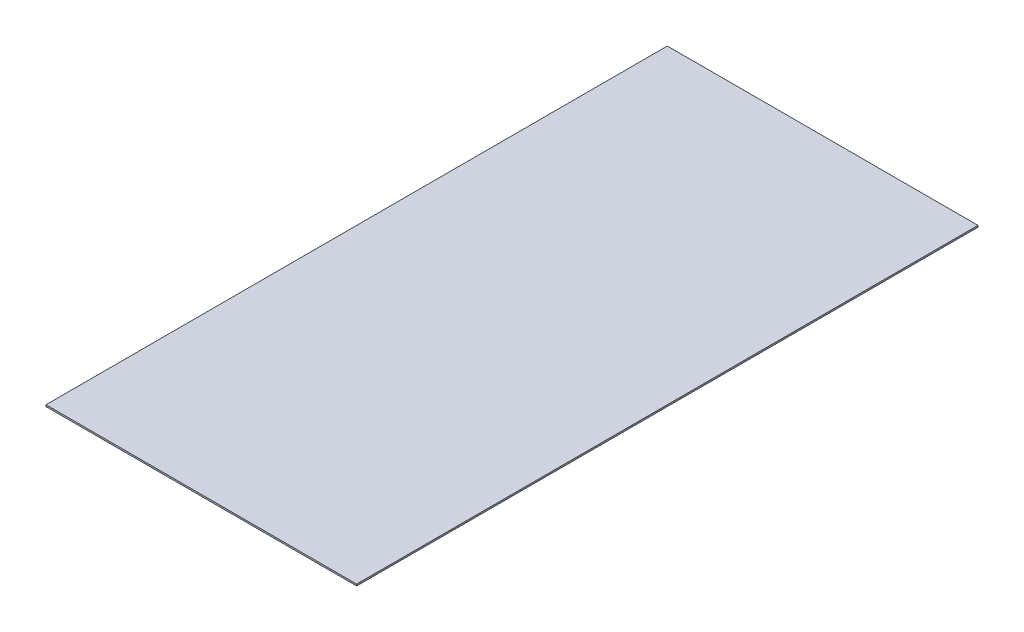
from build123d import *

# Parameters (mm, degrees)
CROQUIS1_W              = 1219.2
CROQUIS1_H              = 2438.4
SALIENTE_EXTRUIR1_DEPTH = 6.4


with BuildPart() as part:
    # Croquis1 → Saliente-Extruir1 (new body)
    with BuildSketch(Plane(origin=(0, 0, 0), x_dir=(1, 0, 0), z_dir=(0, 1, 0))):
        Rectangle(CROQUIS1_W, CROQUIS1_H)
    extrude(amount=SALIENTE_EXTRUIR1_DEPTH)


solid = part.part
